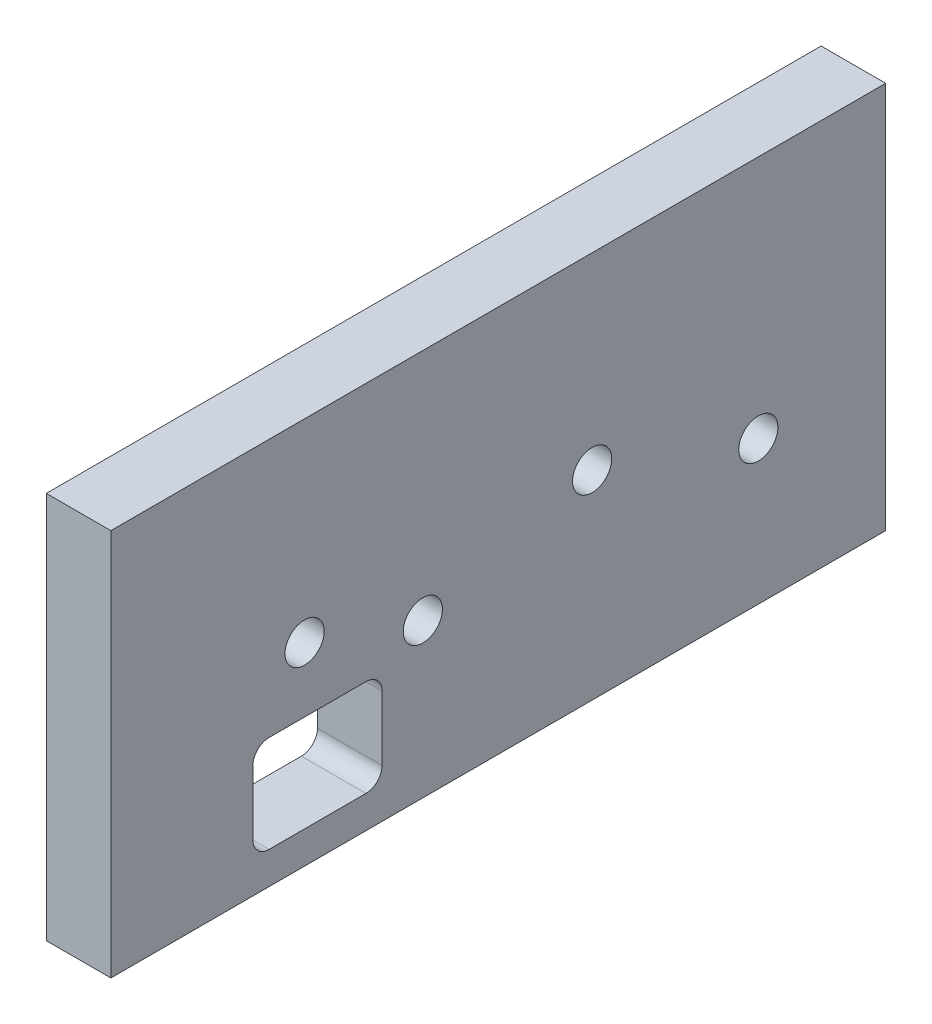
from build123d import *

# Parameters (mm, degrees)
SKETCH1_W                       = 152.4
SKETCH1_H                       = 76.2
SKETCH1_R                       = 3.854557775
BOSS_EXTRUDE1_DEPTH             = 12.7
F_1_4_0_25_DIAMETER_HOLE2_D     = 6.35
F_1_4_0_25_DIAMETER_HOLE2_DEPTH = 38.1
F_1_4_0_25_DIAMETER_HOLE2_TIP   = 1.907732465
SKETCH2_R                       = 7.9375
CUT_EXTRUDE1_DEPTH              = 5.08
CUT_EXTRUDE2_DEPTH              = 87.135590786


with BuildPart() as part:
    # Sketch1 → Boss-Extrude1 (new body)
    with BuildSketch(Plane(origin=(0, 0, 0), x_dir=(0, 0, -1), z_dir=(1, 0, 0))):
        Rectangle(SKETCH1_W, SKETCH1_H)
        with Locations((18.457733582, 1.096077429)):
            Circle(SKETCH1_R, mode=Mode.SUBTRACT)
        with Locations((-38.1, 0)):
            Circle(SKETCH1_R, mode=Mode.SUBTRACT)
        with Locations((-14.836022013, -7.860160654)):
            Circle(SKETCH1_R, mode=Mode.SUBTRACT)
        with Locations((51.143457994, -9.873506971)):
            Circle(SKETCH1_R, mode=Mode.SUBTRACT)
    extrude(amount=BOSS_EXTRUDE1_DEPTH)

    # 1/4 (0.25) Diameter Hole2
    with Locations(Plane.XZ.offset(38.1)):
        with Locations((6.35, 57.15), (6.35, -63.5), (6.35, 0)):
            Hole(F_1_4_0_25_DIAMETER_HOLE2_D / 2, depth=F_1_4_0_25_DIAMETER_HOLE2_DEPTH)
            with Locations((0, 0, -(F_1_4_0_25_DIAMETER_HOLE2_DEPTH + F_1_4_0_25_DIAMETER_HOLE2_TIP / 2))):  # 118° drill point
                Cone(0, F_1_4_0_25_DIAMETER_HOLE2_D / 2, F_1_4_0_25_DIAMETER_HOLE2_TIP, mode=Mode.SUBTRACT)

    # Sketch2 → Cut-Extrude1 (cut)
    with BuildSketch(Plane.ZY):
        with Locations((38.1, 0)):
            Circle(SKETCH2_R)
        with Locations((14.836022013, -7.860160654)):
            Circle(SKETCH2_R)
        with Locations((-18.457733582, 1.096077429)):
            Circle(SKETCH2_R)
        with Locations((-51.143457994, -9.873506971)):
            Circle(SKETCH2_R)
    extrude(amount=-CUT_EXTRUDE1_DEPTH, mode=Mode.SUBTRACT)

    # Sketch5 → Cut-Extrude2 (cut, through all)
    with BuildSketch(Plane.ZY):
        with BuildLine():
            Line((26.035, -12.7), (45.085, -12.7))
            ThreePointArc((45.085, -12.7), (47.33006403, -13.62993597), (48.26, -15.875))
            Line((48.26, -15.875), (48.26, -28.575))
            ThreePointArc((48.26, -28.575), (47.33006403, -30.82006403), (45.085, -31.75))
            Line((45.085, -31.75), (26.035, -31.75))
            ThreePointArc((26.035, -31.75), (23.78993597, -30.82006403), (22.86, -28.575))
            Line((22.86, -28.575), (22.86, -15.875))
            ThreePointArc((22.86, -15.875), (23.78993597, -13.62993597), (26.035, -12.7))
        make_face()
    extrude(amount=-CUT_EXTRUDE2_DEPTH, mode=Mode.SUBTRACT)


solid = part.part
